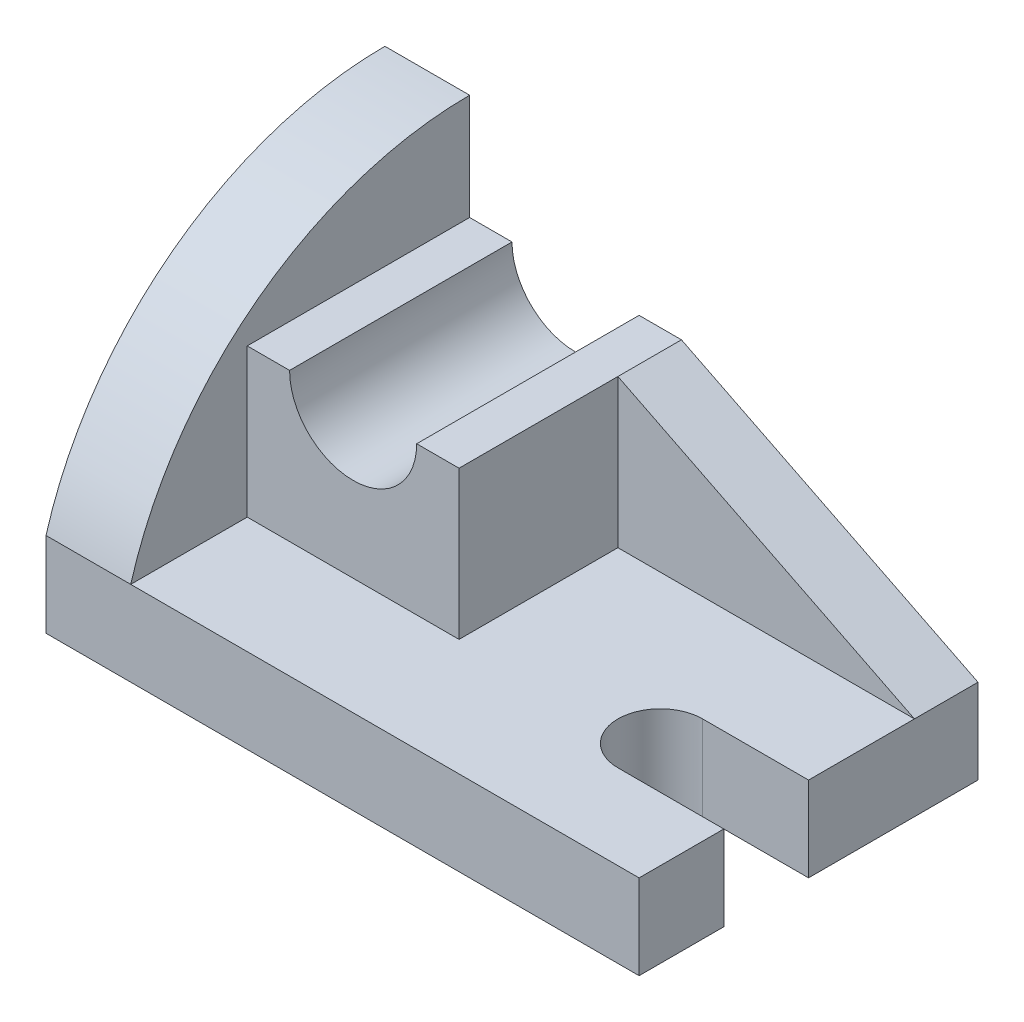
from build123d import *

# Parameters (mm, degrees)
SKETCH1_W               = 96
SKETCH1_H               = 64
BOSS_EXTRUDE1_DEPTH     = 16
CUT_EXTRUDE1_DEPTH      = 60.866518188
CUT_EXTRUDE1_DEPTH_BACK = 16
BOSS_EXTRUDE3_DEPTH     = 12
BOSS_EXTRUDE4_DEPTH     = 42
BOSS_EXTRUDE6_DEPTH     = 16


with BuildPart() as part:
    # Sketch1 → Boss-Extrude1 (new body)
    with BuildSketch(Plane(origin=(0, 0, 0), x_dir=(1, 0, 0), z_dir=(0, 1, 0))):
        Rectangle(SKETCH1_W, SKETCH1_H)
    extrude(amount=BOSS_EXTRUDE1_DEPTH)

    # Sketch2 → Cut-Extrude1 (cut, two sides: drawn at the far end of the back side and taken through both)
    with BuildSketch(Plane(origin=(0, 16, 0), x_dir=(1, 0, 0), z_dir=(0, 1, 0)).offset(-CUT_EXTRUDE1_DEPTH_BACK)):
        with BuildLine():
            Line((28, -16), (48, -16))
            Line((48, -16), (48, 0))
            Line((48, 0), (28, 0))
            ThreePointArc((28, 0), (20, -8), (28, -16))
        make_face()
    extrude(amount=CUT_EXTRUDE1_DEPTH + CUT_EXTRUDE1_DEPTH_BACK, mode=Mode.SUBTRACT)

    # Sketch3 → Boss-Extrude3 (add)
    with BuildSketch(Plane(origin=(0, 0, -32), x_dir=(-1, 0, 0), z_dir=(0, 0, -1))):
        Polygon((-48, 16), (8, 44), (8, 16), align=None)
    extrude(amount=-BOSS_EXTRUDE3_DEPTH)

    # Sketch4 → Boss-Extrude4 (add)
    with BuildSketch(Plane(origin=(0, 0, -32), x_dir=(-1, 0, 0), z_dir=(0, 0, -1))):
        with BuildLine():
            Line((8, 44), (16, 44))
            ThreePointArc((16, 44), (28, 32), (40, 44))
            Line((40, 44), (48, 44))
            Line((48, 44), (48, 16))
            Line((48, 16), (8, 16))
            Line((8, 16), (8, 44))
        make_face()
    extrude(amount=-BOSS_EXTRUDE4_DEPTH)

    # Sketch6 → Boss-Extrude6 (add)
    with BuildSketch(Plane.ZY.offset(48)):
        with BuildLine():
            Line((-32, 0), (-32, 64))
            ThreePointArc((-32, 64), (8, 50.666666667), (32, 16))
            Line((32, 16), (32, 0))
            Line((32, 0), (-32, 0))
        make_face()
    extrude(amount=BOSS_EXTRUDE6_DEPTH)


solid = part.part
